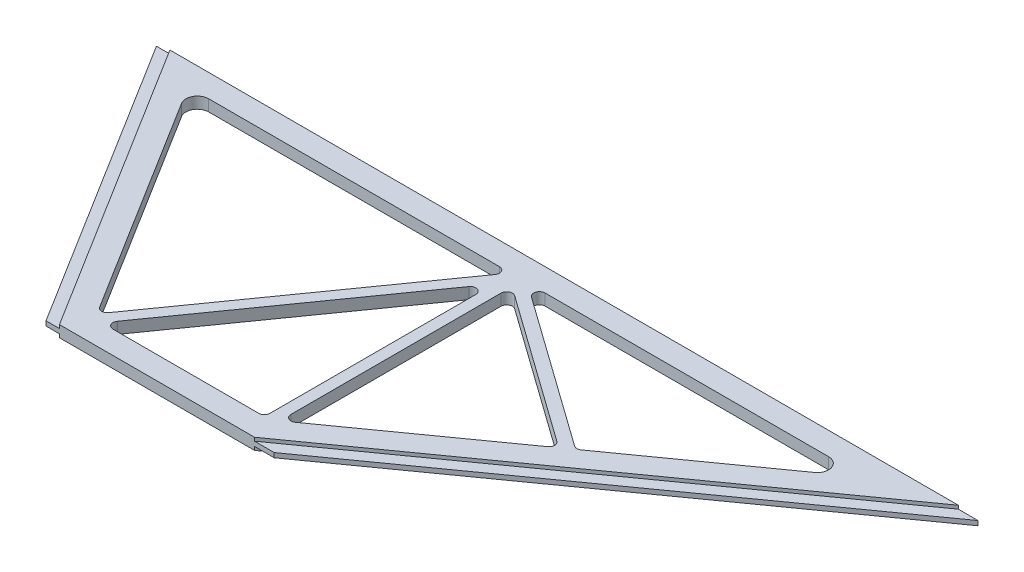
from build123d import *

# Parameters (mm, degrees)
BOSS_EXTRUDE1_DEPTH      = 3.175
BOSS_EXTRUDE1_DEPTH_BACK = 3.175
CUT_EXTRUDE1_DEPTH       = 1.905
CUT_EXTRUDE2_DEPTH       = 6.35
BOSS_EXTRUDE2_DEPTH      = 6.35
FILLET1_R                = 3.175
FILLET2_R                = 6.35


with BuildPart() as part:
    # CS path → Boss-Extrude1 (new, two sides: drawn at the far end of the back side and taken through both)
    with BuildSketch(Plane(origin=(0, 0, 0), x_dir=(1, 0, 0), z_dir=(0, 1, 0)).offset(-BOSS_EXTRUDE1_DEPTH_BACK)):
        Polygon((-228.6, 0), (228.6, 0), (0, -163.068), (-127, -163.068), align=None)
    extrude(amount=BOSS_EXTRUDE1_DEPTH + BOSS_EXTRUDE1_DEPTH_BACK)

    # Sketch1 → Cut-Extrude1 (cut)
    with BuildSketch(Plane(origin=(0, 3.175, 0), x_dir=(1, 0, 0), z_dir=(0, 1, 0))):
        Polygon((-228.6, 0), (-127, -163.068), (-119.518322882, -163.068), (-221.118322882, 0), align=None)
        Polygon((0, -163.068), (228.6, 0), (217.665386403, 0), (-10.934613597, -163.068), align=None)
    cut_extrude1 = extrude(amount=-CUT_EXTRUDE1_DEPTH, mode=Mode.SUBTRACT)

    # Mirror1: Cut-Extrude1 across plane
    add(cut_extrude1.mirror(Plane.ZX), mode=Mode.SUBTRACT)

    # Sketch2 → Cut-Extrude2 (cut)
    with BuildSketch(Plane(origin=(0, 3.175, 0), x_dir=(1, 0, 0), z_dir=(0, 1, 0))):
        Polygon((-198.24219606, -12.7), (177.99242089, -12.7), (-15.000102474, -150.368), (-112.467741232, -150.368), align=None)
    extrude(amount=-CUT_EXTRUDE2_DEPTH, mode=Mode.SUBTRACT)

    # Sketch3 → Boss-Extrude2 (add)
    with BuildSketch(Plane(origin=(0, 3.175, 0), x_dir=(1, 0, 0), z_dir=(0, 1, 0))):
        Polygon((-18.890288084, -12.7), (-114.288712294, -147.445341445), (-112.467741232, -150.368), (-108.577555622, -150.368), (-18.175102474, -22.679209355), (-18.175102474, -150.368), (-15.000102474, -150.368), (-11.825102474, -148.103166667), (-11.825102474, -18.864845516), (78.762505809, -83.484006092), (84.229812607, -79.583993908), (-9.532795675, -12.7), align=None)
    extrude(amount=-BOSS_EXTRUDE2_DEPTH)

    # Fillet1
    fillet1_edges = [part.edges().sort_by_distance(p)[0] for p in [
        (84.229812607, 0, 79.583993908),
        (-114.288712294, 0, 147.445341445),
        (-108.577555622, 0, 150.368),
        (-18.175102474, 0, 150.368),
        (-11.825102474, 0, 148.103166667),
        (78.762505809, 0, 83.484006092),
        (-9.532795675, 0, 12.7),
        (-18.890288084, 0, 12.7),
        (-18.175102474, 0, 22.679209355),
        (-11.825102474, 0, 18.864845516),
    ]]
    fillet(fillet1_edges, radius=FILLET1_R)

    # Fillet2
    fillet2_edges = [part.edges().sort_by_distance(p)[0] for p in [
        (177.99242089, 0, 12.7),
        (-198.24219606, 0, 12.7),
    ]]
    fillet(fillet2_edges, radius=FILLET2_R)


solid = part.part
